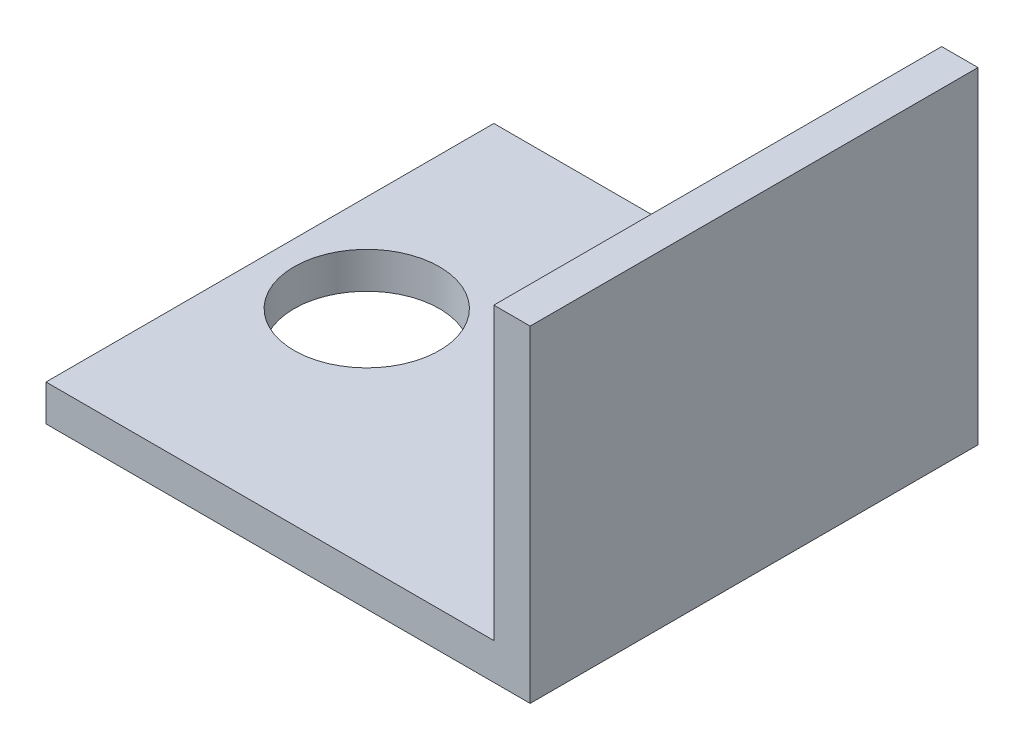
from build123d import *

# Parameters (mm, degrees)
BOSS_EXTRUDE1_DEPTH = 37
SKETCH2_R           = 6
CUT_EXTRUDE1_DEPTH  = 35


with BuildPart() as part:
    # Sketch1 → Boss-Extrude1 (new body)
    with BuildSketch(Plane.XY):
        Polygon((0, 0), (0, -27), (-40, -27), (-40, -24), (-3, -24), (-3, 0), align=None)
    extrude(amount=BOSS_EXTRUDE1_DEPTH)

    # Sketch2 → Cut-Extrude1 (cut)
    with BuildSketch(Plane(origin=(0, -24, 0), x_dir=(1, 0, 0), z_dir=(0, 1, 0))):
        with Locations(Location((-32, -18.5, 0), (0, 0, 180))):
            Circle(SKETCH2_R)
    extrude(amount=-CUT_EXTRUDE1_DEPTH, mode=Mode.SUBTRACT)


solid = part.part
